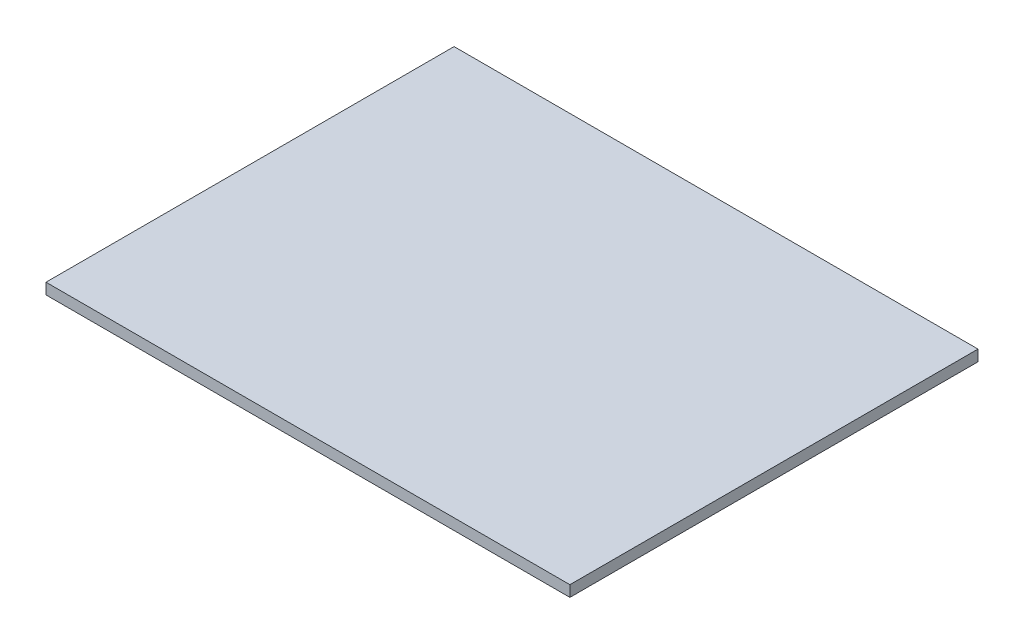
from build123d import *

# Parameters (mm, degrees)
SKETCH1_W           = 475
SKETCH1_H           = 370
BOSS_EXTRUDE1_DEPTH = 10


with BuildPart() as part:
    # Sketch1 → Boss-Extrude1 (new body)
    with BuildSketch(Plane(origin=(0, 0, 0), x_dir=(1, 0, 0), z_dir=(0, 1, 0))):
        Rectangle(SKETCH1_W, SKETCH1_H)
    extrude(amount=BOSS_EXTRUDE1_DEPTH)


solid = part.part
